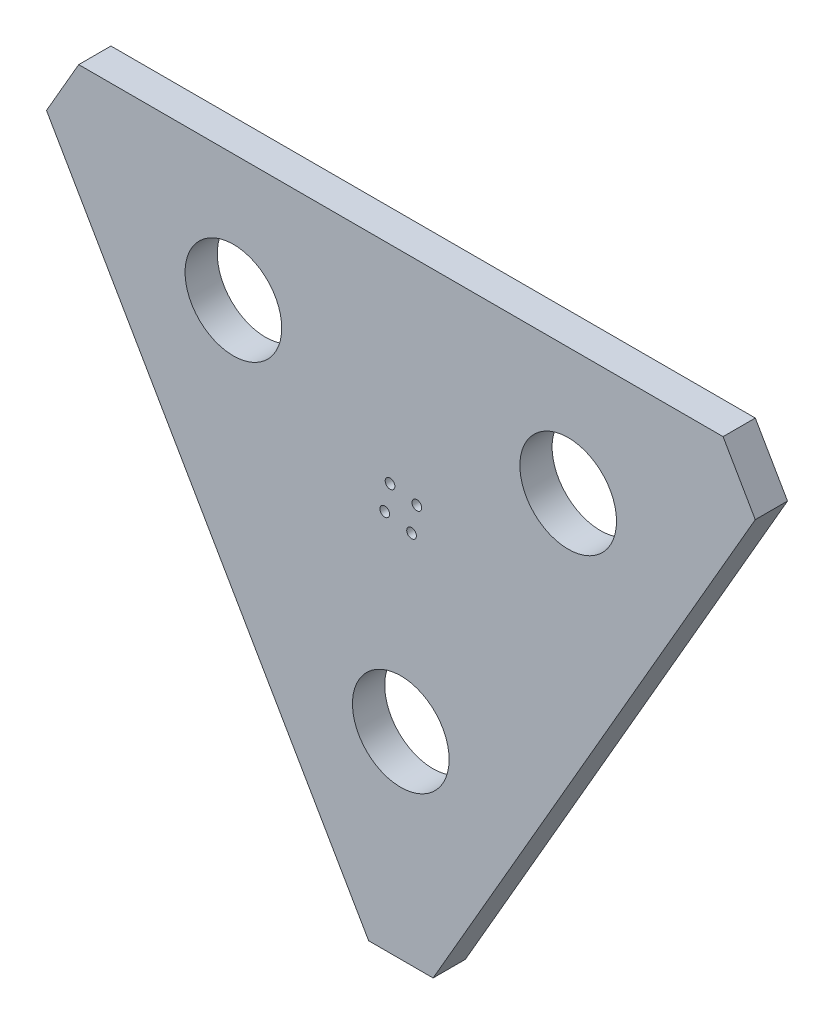
from build123d import *

# Parameters (mm, degrees)
SKETCH5_R           = 15
SKETCH5_R_2         = 1.5
BOSS_EXTRUDE1_DEPTH = 10


with BuildPart() as part:
    # Sketch5 → Boss-Extrude1 (new body)
    with BuildSketch(Plane.XY):
        Polygon((-349.776309557, -150.606198532), (-449.776309557, -323.811279288), (-469.776309557, -323.811279288), (-569.776309557, -150.606198532), (-559.776309557, -133.285690456), (-359.776309557, -133.285690456), align=None)
        with Locations((-407.846346301, -172.585944494)):
            Circle(SKETCH5_R, mode=Mode.SUBTRACT)
        with Locations((-511.769394755, -172.585944494)):
            Circle(SKETCH5_R, mode=Mode.SUBTRACT)
        with Locations((-459.807870528, -262.585944494)):
            Circle(SKETCH5_R, mode=Mode.SUBTRACT)
        with Locations((-463.149814357, -197.602831868)):
            Circle(SKETCH5_R_2, mode=Mode.SUBTRACT)
        with Locations((-454.824757902, -199.244000664)):
            Circle(SKETCH5_R_2, mode=Mode.SUBTRACT)
        with Locations((-456.465926699, -207.56905712)):
            Circle(SKETCH5_R_2, mode=Mode.SUBTRACT)
        with Locations((-464.790983154, -205.927888323)):
            Circle(SKETCH5_R_2, mode=Mode.SUBTRACT)
    extrude(amount=BOSS_EXTRUDE1_DEPTH)


solid = part.part
